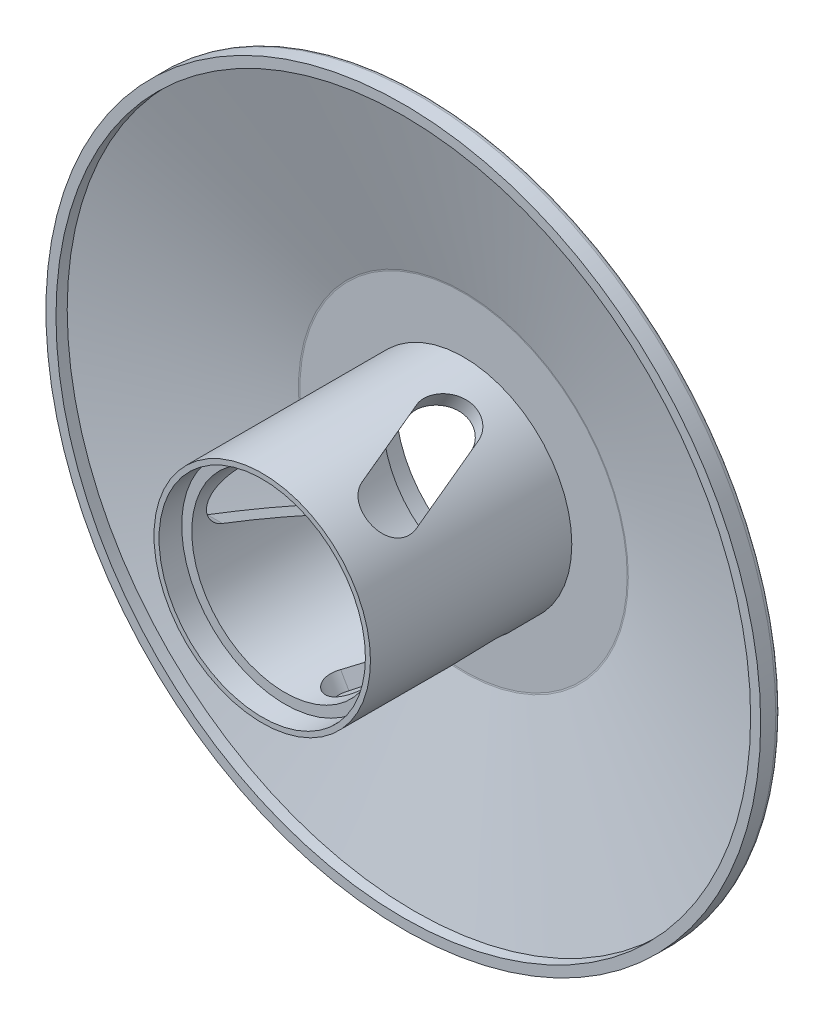
from build123d import *

# Parameters (mm, degrees)
CORTE_EXTRUS_O1_REACH      = 110.839
CORTE_EXTRUS_O1_END_RADIUS = 21.5
PADR_OCIRCULAR1_COUNT      = 3


with BuildPart() as part:
    # Esboço1 → Revolução1 (revolve)
    with BuildSketch(Plane(origin=(0, 0, 0), x_dir=(0, 0, -1), z_dir=(1, 0, 0)), mode=Mode.PRIVATE) as revolu_o1_sk:
        with BuildLine():
            Line((-13.977542355, 71), (-10.977542355, 71))
            ThreePointArc((-10.977542355, 71), (-10.368780926, 70.79335334), (-10.011616529, 70.258819045))
            Line((-10.011616529, 70.258819045), (-0.102222521, 33.276457135))
            ThreePointArc((-0.102222521, 33.276457135), (-0.025665416, 32.891578577), (0, 32.5))
            Line((0, 32.5), (0, 26.5))
            ThreePointArc((0, 26.5), (0.146446609, 26.146446609), (0.5, 26))
            ThreePointArc((0.5, 26), (3.681980515, 24.681980515), (5, 21.5))
            Line((5, 21.5), (5, 20.5))
            Line((5, 20.5), (0.5, 20.5))
            Line((0.5, 20.5), (0.5, 18.5))
            Line((0.5, 18.5), (-37.5, 18.5))
            Line((-37.5, 18.5), (-37.5, 20.5))
            Line((-37.5, 20.5), (-42, 20.5))
            Line((-42, 20.5), (-42, 21.5))
            Line((-42, 21.5), (-2, 21.5))
            Line((-2, 21.5), (-2, 26.5))
            Line((-2, 26.5), (-2, 32.5))
            ThreePointArc((-2, 32.5), (-2.008555139, 32.630526192), (-2.034074174, 32.758819045))
            Line((-2.034074174, 32.758819045), (-11.744869343, 69))
            Line((-11.744869343, 69), (-13.977542355, 69))
            Line((-13.977542355, 69), (-13.977542355, 71))
        make_face()
    revolve(revolu_o1_sk.sketch.rotate(Axis((0, 0, 0), (0, 0, -1)), 90), axis=Axis((0, 0, 0), (0, 0, -1)))

    # Corte-extrusão1: up to this cylinder (the profile starts inside it)
    corte_extrus_o1_end = Plane(origin=(0, 0, 21.326762), z_dir=(0, 0, 1)) * Cylinder(CORTE_EXTRUS_O1_END_RADIUS, 265.678, mode=Mode.PRIVATE)
    # Esboço2 → Corte-extrusão1 (cut, up to the surface)
    with BuildSketch(Plane(origin=(0, 0, 0), x_dir=(0, 0, -1), z_dir=(1, 0, 0)), mode=Mode.PRIVATE) as corte_extrus_o1_sk1:
        with BuildLine():
            Line((-14.579629472, -7.776644394), (-31.494096646, -1.620281814))
            ThreePointArc((-31.494096646, -1.620281814), (-34.482459034, 4.788282007), (-28.073895213, 7.776644394))
            Line((-28.073895213, 7.776644394), (-11.159428039, 1.620281814))
            ThreePointArc((-11.159428039, 1.620281814), (-8.171065652, -4.788282007), (-14.579629472, -7.776644394))
        make_face()
    corte_extrus_o1_tool1 = extrude(corte_extrus_o1_sk1.sketch, amount=-CORTE_EXTRUS_O1_REACH, mode=Mode.PRIVATE) & corte_extrus_o1_end
    corte_extrus_o1 = corte_extrus_o1_tool1.solids().sort_by_distance((0, 0, 21.326762))[0]
    add(corte_extrus_o1, mode=Mode.SUBTRACT)

    # PadrãoCircular1: Corte-extrusão1 ×3 about axis
    padr_ocircular1_axis = Axis((0, 0, 0), (0, 0, 1))
    for i in range(1, PADR_OCIRCULAR1_COUNT):
        add(corte_extrus_o1.rotate(padr_ocircular1_axis, i * 360 / PADR_OCIRCULAR1_COUNT), mode=Mode.SUBTRACT)


solid = part.part
